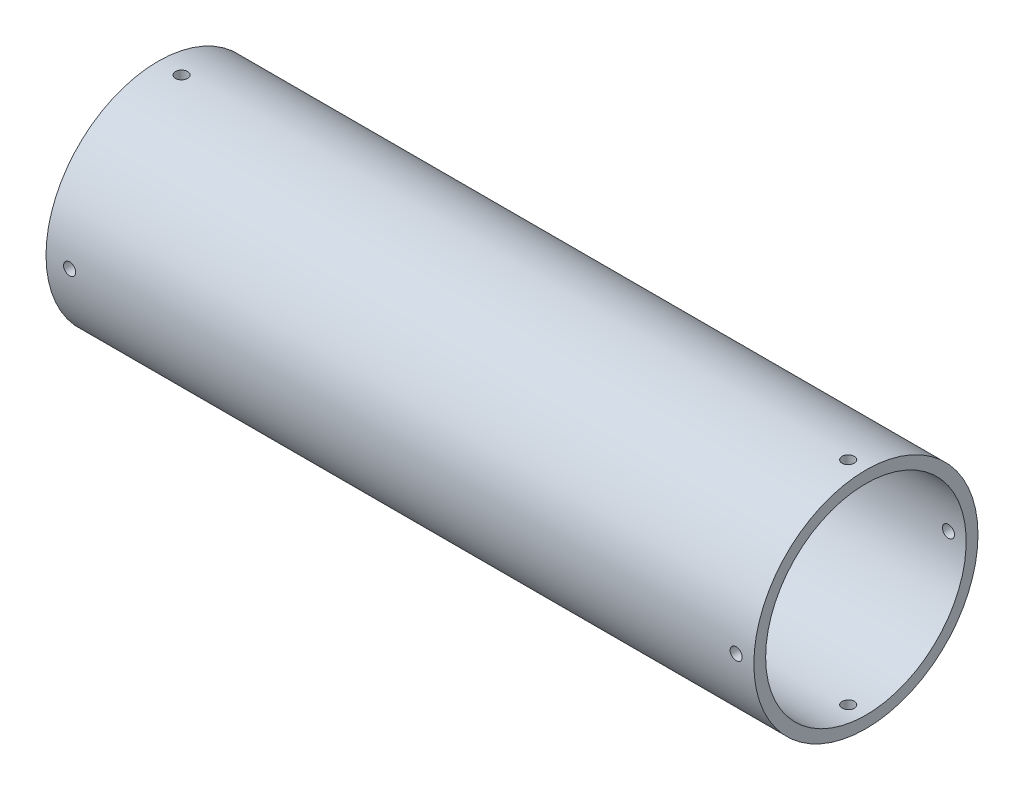
from build123d import *

# Parameters (mm, degrees)
SKETCH1_W                     = 120
SKETCH1_H                     = 2
M2_5_TAPPED_HOLE1_D           = 2.05
M2_5_TAPPED_HOLE1_ON_FACE_2_D = 2.05
M2_5_TAPPED_HOLE2_D           = 2.05
M2_5_TAPPED_HOLE2_ON_FACE_2_D = 2.05


with BuildPart() as part:
    # Sketch1 → Revolve1 (revolve)
    with BuildSketch(Plane.XY):
        with Locations((60, 18)):
            Rectangle(SKETCH1_W, SKETCH1_H)
    revolve(axis=Axis((-97.700575873, 0, 0), (1, 0, 0)))

    # M2.5 Tapped Hole1 (through all)
    with Locations(Plane(origin=(4, 0, 19), x_dir=(1, 0, 0), z_dir=(0, 0, 1))):
        with Locations((0, 0)):
            Hole(M2_5_TAPPED_HOLE1_D / 2)

    # M2.5 Tapped Hole1 on face 2 (through all)
    with Locations(Plane(origin=(4, -19, 0), x_dir=(0, 0, -1), z_dir=(0, -1, 0))):
        with Locations((0, 0)):
            Hole(M2_5_TAPPED_HOLE1_ON_FACE_2_D / 2)

    # M2.5 Tapped Hole2 (through all)
    with Locations(Plane(origin=(117, 19, 0), x_dir=(0, 0, 1), z_dir=(0, 1, 0))):
        with Locations((0, 0)):
            Hole(M2_5_TAPPED_HOLE2_D / 2)

    # M2.5 Tapped Hole2 on face 2 (through all)
    with Locations(Plane(origin=(117, 0, 19), x_dir=(1, 0, 0), z_dir=(0, 0, 1))):
        with Locations((0, 0)):
            Hole(M2_5_TAPPED_HOLE2_ON_FACE_2_D / 2)


solid = part.part
